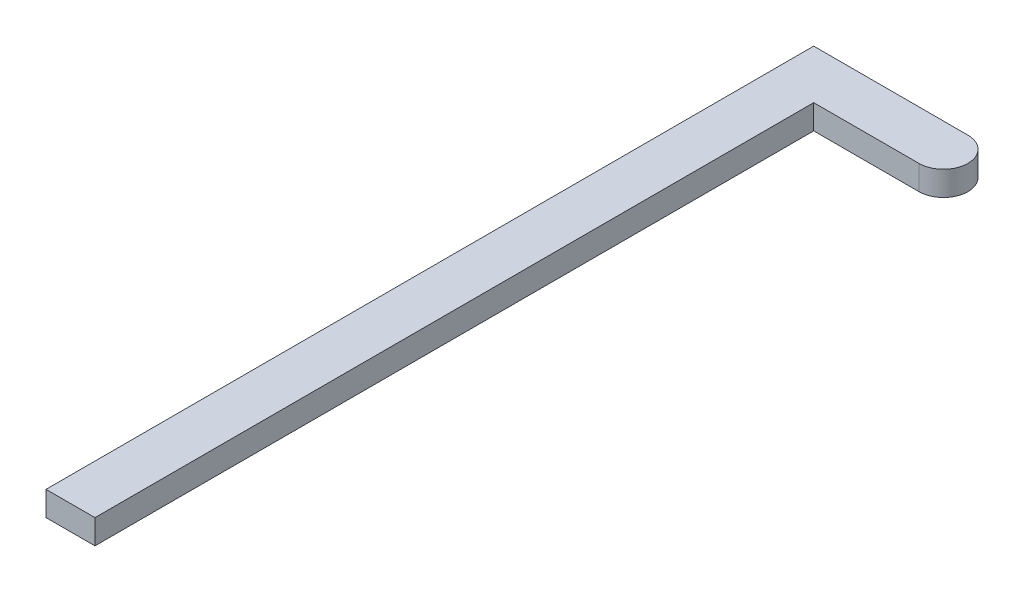
from build123d import *

# Parameters (mm, degrees)
BOSS_EXTRUDE1_DEPTH = 6.35


with BuildPart() as part:
    # Sketch1 → Boss-Extrude1 (new body)
    with BuildSketch(Plane(origin=(0, 0, 0), x_dir=(1, 0, 0), z_dir=(0, 1, 0))):
        with BuildLine():
            Line((0, 6.35), (-40, 6.35))
            Line((-40, 6.35), (-40, -192.786))
            Line((-40, -192.786), (-27.3, -192.786))
            Line((-27.3, -192.786), (-27.3, -6.35))
            Line((-27.3, -6.35), (0, -6.35))
            ThreePointArc((0, -6.35), (6.35, 0), (0, 6.35))
        make_face()
    extrude(amount=BOSS_EXTRUDE1_DEPTH)


solid = part.part
